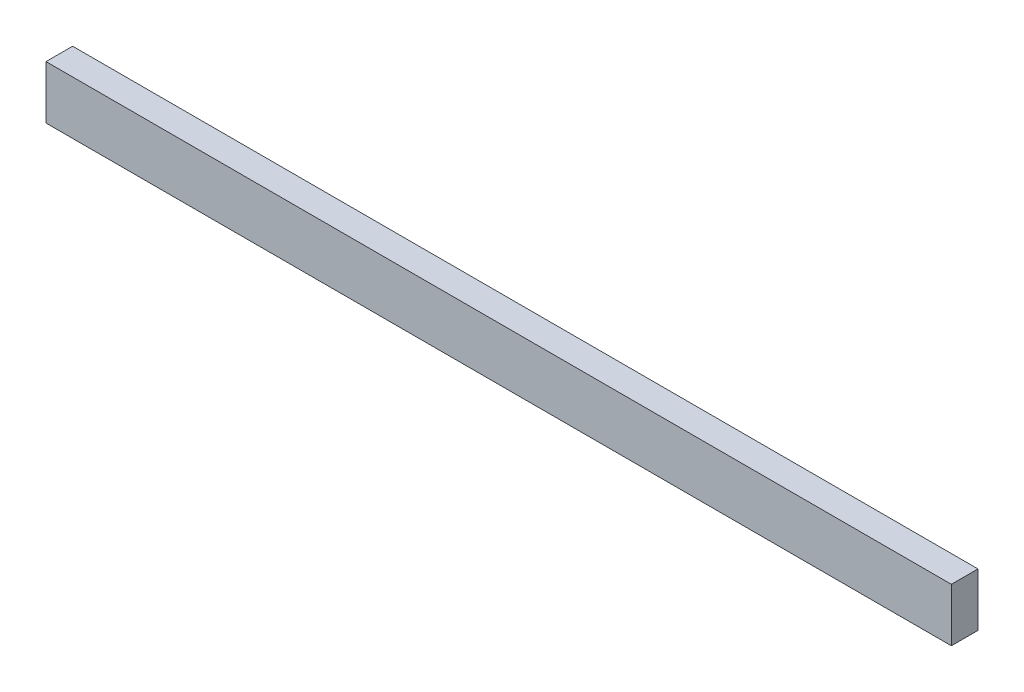
from build123d import *

# Parameters (mm, degrees)
SKETCH_1_W      = 170
SKETCH_1_H      = 10
EXTRUDE_1_DEPTH = 5


with BuildPart() as part:
    # Эскиз1 → Бобышка-Вытянуть1 (new body)
    with BuildSketch(Plane.XY):
        with Locations((85, 5)):
            Rectangle(SKETCH_1_W, SKETCH_1_H)
    extrude(amount=EXTRUDE_1_DEPTH)


solid = part.part
